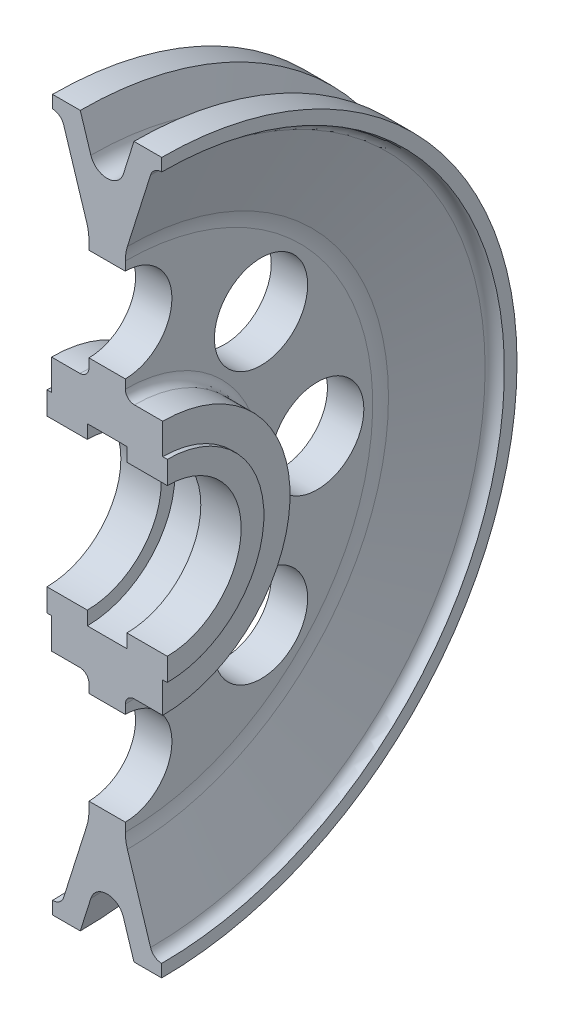
from build123d import *
from build123d.topology import SkipClean

# Parameters (mm, degrees)
FORO_START              = 60
SKETCH2_R               = 41
FORO_DEPTH              = 120
PATTERNFORI_COUNT       = 8
CUT_EXTRUDE1_DEPTH      = 597.549083718
CUT_EXTRUDE1_DEPTH_BACK = 597.549083718
SKETCH4_W               = 608.595706342
SKETCH4_H               = 358.450261249


with BuildPart() as part:
    # Sketch1 → Puleggia (revolve)
    with BuildSketch(Plane.XY):
        with BuildLine():
            Line((14.305754261, 90.102284872), (23.610406599, 119.612871865))
            Line((23.610406599, 119.612871865), (48, 119.612871865))
            Line((48, 119.612871865), (48, 108.49032691))
            ThreePointArc((48, 108.49032691), (41.937089486, 106.505733817), (38.221197059, 101.320211941))
            Line((38.221197059, 101.320211941), (17.85132197, 36.715221983))
            ThreePointArc((17.85132197, 36.715221983), (16.465539581, 30.77192545), (16, 24.686990003))
            Line((16, 24.686990003), (16, -72.887128135))
            ThreePointArc((16, -72.887128135), (18.343145751, -78.543982385), (24, -80.887128135))
            Line((24, -80.887128135), (48.9, -80.887128135))
            Line((48.9, -80.887128135), (48.9, -115.887128135))
            Line((48.9, -115.887128135), (0, -115.887128135))
            Line((0, -115.887128135), (0, 79.612871865))
            ThreePointArc((0, 79.612871865), (8.869644725, 82.516202801), (14.305754261, 90.102284872))
        make_face()
    puleggia = revolve(axis=Axis((-62.254886415, -192.887128135, 0), (1, 0, 0)))

    # Mirror 2: Puleggia across plane
    with SkipClean():  # the faces are left unmerged after this step: merging them gives an invalid solid
        add(puleggia.mirror(Plane(origin=(0, 79.612871865, 0), x_dir=(0, 0, 1), z_dir=(1, 0, 0))))

    # Sketch2 → Foro (cut)
    with SkipClean():  # the faces are left unmerged after this step: merging them gives an invalid solid
        with BuildSketch(Plane(origin=(0, 0, 0), x_dir=(0, 0, -1), z_dir=(1, 0, 0)).offset(FORO_START)):
            with Locations((0, -24.100069066)):
                Circle(SKETCH2_R)
        foro = extrude(amount=-FORO_DEPTH, mode=Mode.SUBTRACT)

    # PatternFori: Foro ×8 about axis
    with SkipClean():  # the faces are left unmerged after this step: merging them gives an invalid solid
        patternfori_axis = Axis((48.9, -192.887128135, 0), (-1, 0, 0))
        for i in range(1, PATTERNFORI_COUNT):
            add(foro.rotate(patternfori_axis, i * 360 / PATTERNFORI_COUNT), mode=Mode.SUBTRACT)

    # Sketch3 → Revolve1 (revolve)
    with SkipClean():  # the faces are left unmerged after this step: merging them gives an invalid solid
        with BuildSketch(Plane.XY):
            Polygon((48.9, -115.887128135), (48.9, -107.887128135), (52.9, -107.887128135), (52.9, -127.887128135), (48.203298426, -127.887128135), (17.4, -127.887128135), (17.4, -115.887128135), align=None)
        revolve1 = revolve(axis=Axis((48.9, -192.887128135, 0), (-1, 0, 0)))

    # Mirror1: Revolve1 across plane
    with SkipClean():  # the faces are left unmerged after this step: merging them gives an invalid solid
        add(revolve1.mirror(Plane(origin=(0, 0, 0), x_dir=(0, 0, 1), z_dir=(1, 0, 0))))

    # Sketch4 → Cut-Extrude1 (cut, two sides: drawn at the far end of the back side and taken through both)
    with SkipClean():  # the faces are left unmerged after this step: merging them gives an invalid solid
        with BuildSketch(Plane(origin=(0, 0, 0), x_dir=(1, 0, 0), z_dir=(0, 1, 0)).offset(-CUT_EXTRUDE1_DEPTH_BACK)):
            with Locations((-69.439614581, -179.225130625)):
                Rectangle(SKETCH4_W, SKETCH4_H)
        extrude(amount=CUT_EXTRUDE1_DEPTH + CUT_EXTRUDE1_DEPTH_BACK, mode=Mode.SUBTRACT)


solid = part.part
